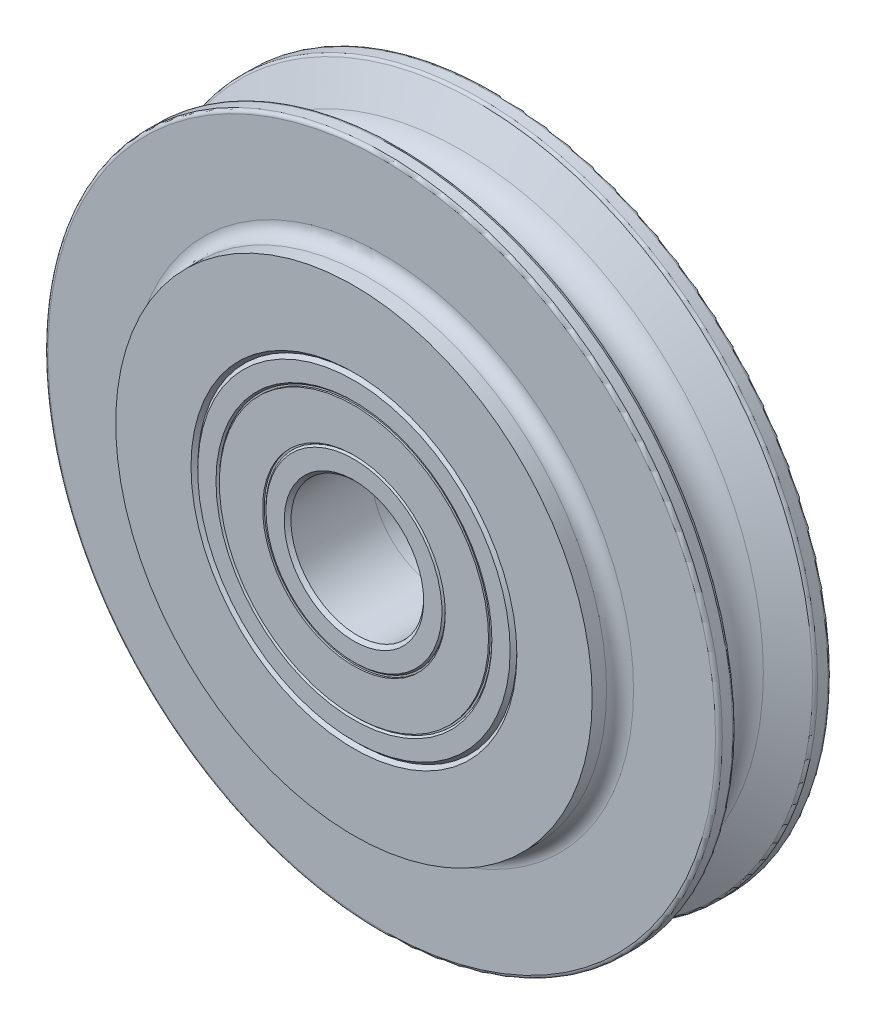
from build123d import *
from build123d.topology import SkipClean

# Parameters (mm, degrees)
CHAMFER1_SIZE      = 0.381
SKETCH5_W          = 1.524
SKETCH5_H          = 10.534
SKETCH7_R          = 30.801
SKETCH7_R_2        = 30.42
SKETCH7_R_3        = 20.648
SKETCH7_R_4        = 20.267
CUT_EXTRUDE1_DEPTH = 0.381
CHAMFER4_SIZE      = 0.762


with BuildPart() as part:
    # Sketch4 → Revolve1 (revolve)
    with BuildSketch(Plane(origin=(0, 0, 0), x_dir=(0, 0, -1), z_dir=(1, 0, 0)), mode=Mode.PRIVATE) as revolve1_sk:
        Polygon((-18.9992, 15), (0, 15), (0, 36.068), (-18.2372, 36.068), (-18.9992, 35.306), (-18.9992, 30.801), (-17.4752, 30.801), (-17.4752, 20.267), (-18.9992, 20.267), align=None)
    revolve(revolve1_sk.sketch.rotate(Axis((0, 0, 18.9992), (0, 0, -1)), 90), axis=Axis((0, 0, 18.9992), (0, 0, -1)))

    # Chamfer1
    chamfer1_edges = [part.edges().sort_by_distance(p)[0] for p in [
        (-20.267, 0, 18.9992),
        (-30.801, 0, 18.9992),
    ]]
    chamfer(chamfer1_edges, length=CHAMFER1_SIZE)

    # Chamfer4
    chamfer4_edges = [part.edges().sort_by_distance(p)[0] for p in [
        (-15, 0, 18.9992),
    ]]
    chamfer(chamfer4_edges, length=CHAMFER4_SIZE)


with BuildPart() as body_2:
    # Sketch5 → Revolve2 (revolve)
    with BuildSketch(Plane(origin=(0, 0, 0), x_dir=(0, 0, -1), z_dir=(1, 0, 0)), mode=Mode.PRIVATE) as revolve2_sk:
        with Locations((-18.2372, 25.534)):
            Rectangle(SKETCH5_W, SKETCH5_H)
    revolve(revolve2_sk.sketch.rotate(Axis((0, 0, 18.9992), (0, 0, -1)), 90), axis=Axis((0, 0, 18.9992), (0, 0, -1)))

    # Sketch7 → Cut-Extrude1 (cut)
    # profile 1 of 2: a face of its own
    with BuildSketch(Plane.XY.offset(18.9992)):
        Circle(SKETCH7_R)
        Circle(SKETCH7_R_2, mode=Mode.SUBTRACT)
    # profile 2 of 2: a face of its own
    with BuildSketch(Plane.XY.offset(18.9992)):
        Circle(SKETCH7_R_3)
        Circle(SKETCH7_R_4, mode=Mode.SUBTRACT)
    extrude(amount=-CUT_EXTRUDE1_DEPTH, mode=Mode.SUBTRACT)


with BuildPart() as body_3:
    # Mirror1: mirrored copy
    add(body_2.part.mirror(Plane.XY))


with BuildPart() as body_4:
    # Mirror1 2: mirrored copy
    add(part.part.mirror(Plane.XY))


with BuildPart() as body_5:
    # Sketch6 → Revolve3 (revolve)
    with BuildSketch(Plane(origin=(0, 0, 0), x_dir=(0, 0, -1), z_dir=(1, 0, 0)), mode=Mode.PRIVATE) as revolve3_sk:
        with BuildLine():
            Line((-18.2372, 36.068), (-18.9992, 36.83))
            Line((-18.9992, 36.83), (-18.9992, 53.848))
            Line((-18.9992, 53.848), (-15.748, 53.848))
            ThreePointArc((-15.748, 53.848), (-13.592738531, 54.740738531), (-12.7, 56.896))
            Line((-12.7, 56.896), (-12.7, 75.438))
            ThreePointArc((-12.7, 75.438), (-12.476815367, 75.976815367), (-11.938, 76.2))
            Line((-11.938, 76.2), (-9.589925018, 76.2))
            ThreePointArc((-9.589925018, 76.2), (-9.186126538, 76.084212649), (-8.905043954, 75.772038814))
            Line((-8.905043954, 75.772038814), (-5.250754818, 68.27963576))
            ThreePointArc((-5.250754818, 68.27963576), (-3.095788342, 65.886303022), (0, 64.9986))
            Line((0, 64.9986), (0, 36.068))
            Line((0, 36.068), (-18.2372, 36.068))
        make_face()
    revolve(revolve3_sk.sketch.rotate(Axis((0, 0, 18.9992), (0, 0, -1)), 90), axis=Axis((0, 0, 18.9992), (0, 0, -1)))

    # Mirror2: body 5 across plane


with BuildPart() as body_5_1:
    with SkipClean():  # the faces are left unmerged after this step: merging them gives an invalid solid
        add(body_5.part)
        add(body_5.part.mirror(Plane(origin=(0, 64.9986, 0), x_dir=(1, 0, 0), z_dir=(0, 0, 1))))


solid = Compound([part.part, body_2.part, body_3.part, body_4.part, body_5_1.part])
